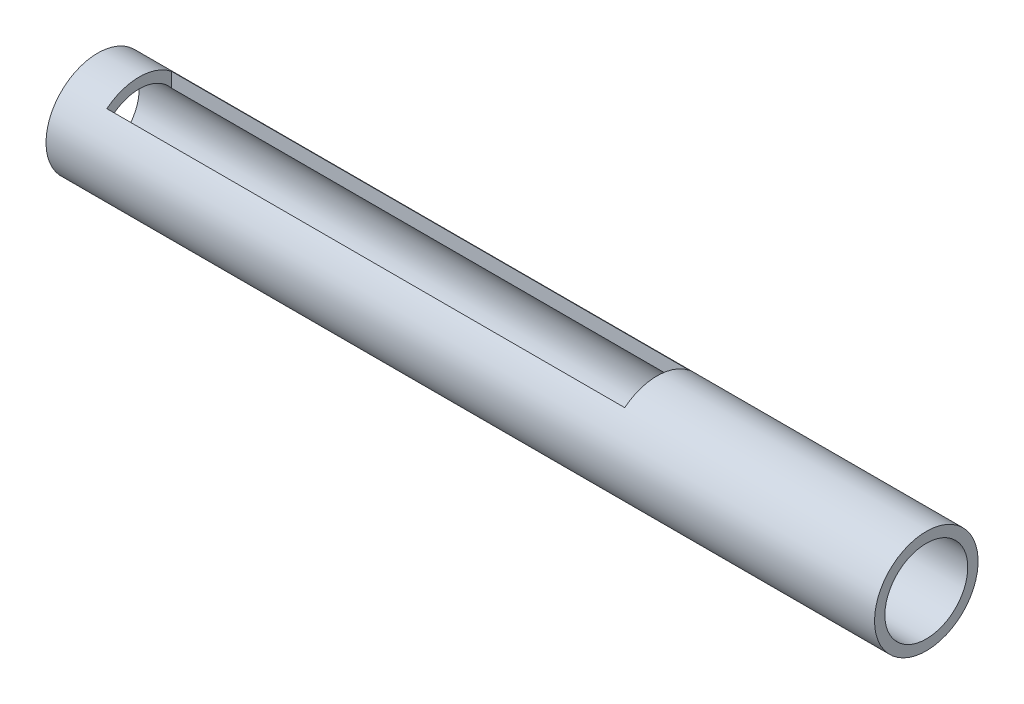
from build123d import *

# Parameters (mm, degrees)
SKETCH3_W          = 400
SKETCH3_H          = 25
SKETCH5_R          = 20
CUT_EXTRUDE3_DEPTH = 403.550581854
SKETCH8_W          = 250
SKETCH8_H          = 31.237018092
CUT_EXTRUDE2_DEPTH = 78


with BuildPart() as part:
    # Sketch3 → Revolve1 (revolve)
    with BuildSketch(Plane.XY, mode=Mode.PRIVATE) as revolve1_sk:
        with Locations((27.926421405, 25.2090301)):
            Rectangle(SKETCH3_W, SKETCH3_H)
    revolve(revolve1_sk.sketch.rotate(Axis((-172.073578595, 12.7090301, 0), (1, 0, 0)), 90), axis=Axis((-172.073578595, 12.7090301, 0), (1, 0, 0)))

    # Sketch5 → Cut-Extrude3 (cut, through all)
    with BuildSketch(Plane.ZY.offset(172.073578595)):
        with Locations((0, 12.7090301)):
            Circle(SKETCH5_R)
    extrude(amount=-CUT_EXTRUDE3_DEPTH, mode=Mode.SUBTRACT)

    # Sketch8 → Cut-Extrude2 (cut)
    with BuildSketch(Plane(origin=(0, 100, 0), x_dir=(1, 0, 0), z_dir=(0, 1, 0))):
        with Locations((-27.073578595, 0)):
            Rectangle(SKETCH8_W, SKETCH8_H)
    extrude(amount=-CUT_EXTRUDE2_DEPTH, mode=Mode.SUBTRACT)


solid = part.part
